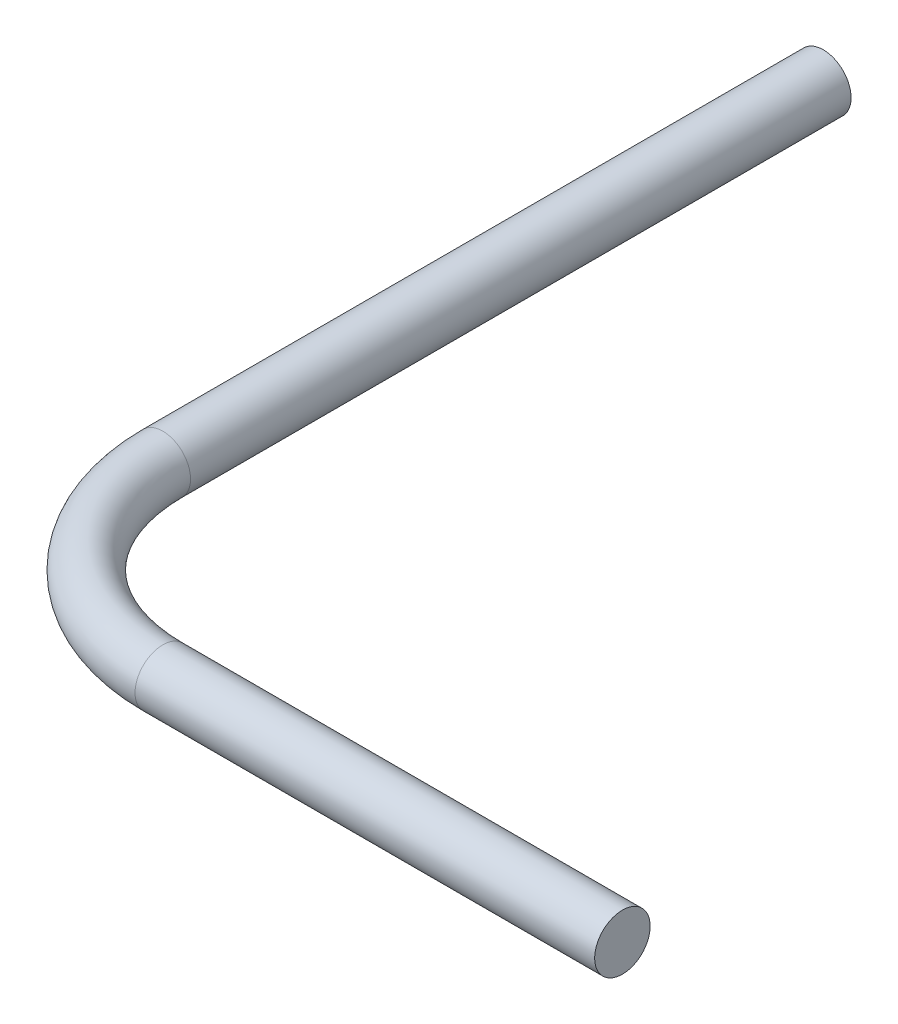
from build123d import *

# Parameters (mm, degrees)
BARRER1_PROFILE_R = 1.5


with BuildPart() as part:
    # Barrer1: sweep along a path in Croquis2
    with BuildLine(Plane(origin=(0, 0, 0), x_dir=(1, 0, 0), z_dir=(0, 1, 0))) as barrer1_path:
        Line((0, 0), (-24.84, 0))
        ThreePointArc((-24.84, 0), (-31.911067812, 2.928932188), (-34.84, 10))
        Line((-34.84, 10), (-34.84, 45.7))
    # Barrer1 profile (on start of the path) → Barrer1 (sweep)
    with BuildSketch(Plane(origin=(0, 0, 0), x_dir=(0, 0, -1), z_dir=(-1, 0, 0))):
        Circle(BARRER1_PROFILE_R)
    sweep(path=barrer1_path.line)


solid = part.part
